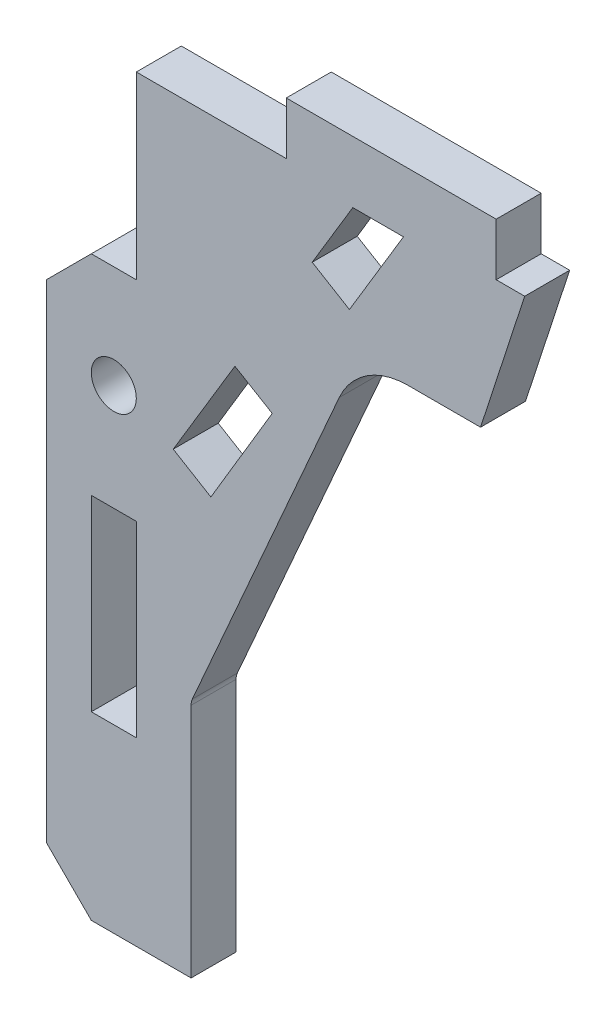
from build123d import *

# Parameters (mm, degrees)
SKETCH_1_R           = 1.5
SKETCH_1_W           = 3
SKETCH_1_H           = 12.5
EXTRUDE_1_DEPTH      = 3
SKETCH_2_W           = 3
SKETCH_2_H           = 15
SKETCH_2_H_2         = 10
CUT_EXTRUDE_1_DEPTH  = 5
CUT_EXTRUDE_2_DEPTH  = 45.402252195
CUT_EXTRUDE_3_DEPTH  = 10
CUT_EXTRUDE_4_DEPTH  = 10
EXTRUDE_2_DEPTH      = 3
EXTRUDE_3_DEPTH      = 3
CUT_EXTRUDE_5_DEPTH  = 8
FILLET_2_R           = 5
EXTRUDE_START        = -3
EXTRUDE_4_DEPTH      = 3
FILLET_3_R           = 2
EXTRUDE_5_DEPTH      = 3
FILLET_4_R           = 2
CUT_EXTRUDE_6_DEPTH  = 6
CUT_EXTRUDE_7_DEPTH  = 10
CUT_EXTRUDE_8_DEPTH  = 10
SKETCH_17_W          = 7
SKETCH_17_H          = 6.292526031
CUT_EXTRUDE_9_DEPTH  = 5
SKETCH_18_W          = 19.9
SKETCH_18_H          = 3.108254453
CUT_EXTRUDE_10_DEPTH = 45.402252195
EXTRUDE_6_DEPTH      = 3
SKETCH_20_W          = 3
SKETCH_20_H          = 12.985743467
EXTRUDE_7_DEPTH      = 7
EXTRUDE_9_DEPTH      = 3
EXTRUDE_10_DEPTH     = 5
EXTRUDE_11_DEPTH     = 3
FILLET_7_R           = 5
CUT_EXTRUDE_11_DEPTH = 10
FILLET_8_R           = 10
CUT_EXTRUDE_13_DEPTH = 10
SKETCH_32_W          = 3
SKETCH_32_H          = 8.565761419
EXTRUDE_12_DEPTH     = 0.5
FILLET_10_R          = 3
SKETCH_33_W          = 3
SKETCH_33_H          = 9.039454816
CUT_EXTRUDE_14_DEPTH = 5
CUT_EXTRUDE_15_DEPTH = 10
CUT_EXTRUDE_START    = -10
CUT_EXTRUDE_16_DEPTH = 10
CUT_EXTRUDE_18_DEPTH = 3
CUT_EXTRUDE_19_DEPTH = 10
CUT_EXTRUDE_20_DEPTH = 10
FILLET_11_R          = 1


with BuildPart() as part:
    # 草图1 → 凸台-拉伸1 (new body)
    with BuildSketch(Plane.XY):
        Polygon((-28.4, -17), (-25.4, -20), (-22.4, -20), (-22.4, -27.5), (17.4, -27.5), (17.4, -20), (22.4, -20), (22.4, -5), (17.4, -5), (17.4, 10), (22.4, 10), (22.4, 20), (17.4, 20), (17.4, 30.5), (1.6, 30.5), (1.6, 34), (-12.4, 34), (-12.4, 30.5), (-22.4, 30.5), (-22.4, 18.5), (-25.4, 18.5), (-28.4, 15.5), align=None)
        with Locations((-23.9, 11.645115951)):
            Circle(SKETCH_1_R, mode=Mode.SUBTRACT)
        with Locations((-23.9, -1.701184373)):
            Rectangle(SKETCH_1_W, SKETCH_1_H, mode=Mode.SUBTRACT)
        with BuildLine():
            Line((-0.943408492, 20.723063417), (-16.494006981, -16.074007029))
            ThreePointArc((-16.494006981, -16.074007029), (-16.597951499, -16.391745547), (-16.647518347, -16.722359153))
            Line((-16.647518347, -16.722359153), (-16.87747423, -20.247507648))
            ThreePointArc((-16.87747423, -20.247507648), (-16.341232813, -21.745107114), (-14.881716036, -22.377696869))
            Line((-14.881716036, -22.377696869), (7.4, -22.377696869))
            ThreePointArc((7.4, -22.377696869), (8.814213562, -21.791910432), (9.4, -20.377696869))
            Line((9.4, -20.377696869), (9.4, 19.944522071))
            ThreePointArc((9.4, 19.944522071), (8.814213562, 21.358735634), (7.4, 21.944522071))
            Line((7.4, 21.944522071), (0.898838335, 21.944522071))
            ThreePointArc((0.898838335, 21.944522071), (-0.206357871, 21.611417792), (-0.943408492, 20.723063417))
        make_face(mode=Mode.SUBTRACT)
    extrude(amount=EXTRUDE_1_DEPTH)

    # 草图2 → 切除-拉伸1 (cut)
    with BuildSketch(Plane(origin=(22.4, 0, 0), x_dir=(0, 0, -1), z_dir=(1, 0, 0))):
        with Locations((-1.5, -12.5)):
            Rectangle(SKETCH_2_W, SKETCH_2_H)
        with Locations((-1.5, 15)):
            Rectangle(SKETCH_2_W, SKETCH_2_H_2)
    extrude(amount=-CUT_EXTRUDE_1_DEPTH, mode=Mode.SUBTRACT)

    # 草图4 → 切除-拉伸2 (cut, through all)
    with BuildSketch(Plane(origin=(0, 0, 0), x_dir=(-1, 0, 0), z_dir=(0, 0, -1))):
        Polygon((-7.4, 21.944522071), (-17.4, 21.944522071), (-17.4, 1.5), (-9.4, 1.5), align=None)
    extrude(amount=-CUT_EXTRUDE_2_DEPTH, mode=Mode.SUBTRACT)

    # 草图5 → 切除-拉伸3 (cut)
    with BuildSketch(Plane(origin=(0, 0, 0), x_dir=(-1, 0, 0), z_dir=(0, 0, -1))):
        Polygon((-7.4, -22.377696869), (-17.4, -22.377696869), (-17.4, 1.5), (-9.4, 1.5), align=None)
    extrude(amount=-CUT_EXTRUDE_3_DEPTH, mode=Mode.SUBTRACT)

    # 草图6 → 切除-拉伸4 (cut)
    with BuildSketch(Plane(origin=(0, 0, 0), x_dir=(-1, 0, 0), z_dir=(0, 0, -1))):
        Polygon((-0.898838335, 21.944522071), (10.541314431, 21.944522071), (16.597951499, -16.391745547), align=None)
    extrude(amount=-CUT_EXTRUDE_4_DEPTH, mode=Mode.SUBTRACT)

    # 草图8 → 凸台-拉伸2 (add)
    with BuildSketch(Plane(origin=(0, 0, 0), x_dir=(-1, 0, 0), z_dir=(0, 0, -1))):
        with BuildLine():
            Line((14.881716036, -22.377696869), (-17.4, -22.377696869))
            Line((-17.4, -22.377696869), (-17.4, -16.722359153))
            Line((-17.4, -16.722359153), (16.647518347, -16.722359153))
            Line((16.647518347, -16.722359153), (16.87747423, -20.247507648))
            ThreePointArc((16.87747423, -20.247507648), (16.341232813, -21.745107114), (14.881716036, -22.377696869))
        make_face()
    extrude(amount=-EXTRUDE_2_DEPTH)

    # 草图9 → 凸台-拉伸3 (add)
    with BuildSketch(Plane(origin=(0, 0, 0), x_dir=(-1, 0, 0), z_dir=(0, 0, -1))):
        with BuildLine():
            Line((16.647518347, -16.722359153), (-17.4, -16.722359153))
            Line((-17.4, -16.722359153), (-17.4, -16.391745547))
            Line((-17.4, -16.391745547), (16.597951499, -16.391745547))
            ThreePointArc((16.597951499, -16.391745547), (16.629654964, -16.556014871), (16.647518347, -16.722359153))
        make_face()
    extrude(amount=-EXTRUDE_3_DEPTH)

    # 草图10 → 切除-拉伸5 (cut)
    with BuildSketch(Plane(origin=(0, 0, 0), x_dir=(-1, 0, 0), z_dir=(0, 0, -1))):
        Polygon((16.597951499, -16.391745547), (-17.4, -16.391745547), (-17.4, -18.391745547), (16.913925768, -18.391745547), align=None)
    extrude(amount=-CUT_EXTRUDE_5_DEPTH, mode=Mode.SUBTRACT)

    # 圆角2
    fillet_2_edges = [part.edges().sort_by_distance(p)[0] for p in [
        (-10.541314431, 21.944522071, 1.5),
    ]]
    fillet(fillet_2_edges, radius=FILLET_2_R)

    # 草图11 → 凸台-拉伸4 (add)
    with BuildSketch(Plane(origin=(0, 0, 0), x_dir=(-1, 0, 0), z_dir=(0, 0, -1)).offset(EXTRUDE_START)):
        with BuildLine():
            Line((6.269234856, 21.944522071), (11.207979364, 17.724780164))
            ThreePointArc((11.207979364, 17.724780164), (9.517211883, 20.745922501), (6.269234856, 21.944522071))
        make_face()
    extrude(amount=EXTRUDE_4_DEPTH)

    # 圆角3
    fillet_3_edges = [part.edges().sort_by_distance(p)[0] for p in [
        (-6.269234856, 21.944522071, 1.5),
        (-11.207979364, 17.724780164, 1.5),
    ]]
    fillet(fillet_3_edges, radius=FILLET_3_R)

    # 草图12 → 凸台-拉伸5 (add)
    with BuildSketch(Plane.XY.offset(3)):
        with BuildLine():
            Line((-7.981733094, 20.481336322), (-10.646847695, 18.204219992))
            ThreePointArc((-10.646847695, 18.204219992), (-11.092932914, 17.660394983), (-11.323154687, 16.995763057))
            Line((-11.323154687, 16.995763057), (-12.341298757, 10.55128849))
            Line((-12.341298757, 10.55128849), (-7.981733094, 20.481336322))
        make_face()
    extrude(amount=-EXTRUDE_5_DEPTH)

    # 圆角4
    fillet_4_edges = [part.edges().sort_by_distance(p)[0] for p in [
        (-7.981733094, 20.481336322, 1.5),
        (-12.341298757, 10.55128849, 1.5),
    ]]
    fillet(fillet_4_edges, radius=FILLET_4_R)

    # 草图14 → 切除-拉伸6 (cut)
    with BuildSketch(Plane.XY.offset(3)):
        with BuildLine():
            Line((-8.165767584, 20.062149772), (-6.345855602, 24.207473969))
            Line((-6.345855602, 24.207473969), (17.4, 24.207473969))
            Line((17.4, 24.207473969), (17.4, 21.944522071))
            Line((17.4, 21.944522071), (-5.531175714, 21.944522071))
            ThreePointArc((-5.531175714, 21.944522071), (-6.223591649, 21.820837655), (-6.830366525, 21.465082243))
            Line((-6.830366525, 21.465082243), (-7.633672538, 20.7787248))
            ThreePointArc((-7.633672538, 20.7787248), (-7.940203056, 20.450498062), (-8.165767584, 20.062149772))
        make_face()
    extrude(amount=-CUT_EXTRUDE_6_DEPTH, mode=Mode.SUBTRACT)

    # 草图15 → 切除-拉伸7 (cut)
    with BuildSketch(Plane.XY.offset(3)):
        Polygon((17.4, -18.391745547), (17.4, -22.391745547), (-17.545874306, -22.391745547), (-16.913925768, -18.391745547), align=None)
    extrude(amount=-CUT_EXTRUDE_7_DEPTH, mode=Mode.SUBTRACT)

    # 草图16 → 切除-拉伸8 (cut)
    with BuildSketch(Plane.XY.offset(3)):
        Polygon((17.4, -22.391745547), (17.4, -24.391745547), (-17.861848575, -24.391745547), (-17.545874306, -22.391745547), align=None)
    extrude(amount=-CUT_EXTRUDE_8_DEPTH, mode=Mode.SUBTRACT)

    # 草图17 → 切除-拉伸9 (cut)
    with BuildSketch(Plane.XY.offset(3)):
        with Locations((13.9, 27.353736985)):
            Rectangle(SKETCH_17_W, SKETCH_17_H)
    extrude(amount=-CUT_EXTRUDE_9_DEPTH, mode=Mode.SUBTRACT)

    # 草图18 → 切除-拉伸10 (cut, through all)
    with BuildSketch(Plane.XY.offset(3)):
        with Locations((7.45, -25.945872773)):
            Rectangle(SKETCH_18_W, SKETCH_18_H)
    extrude(amount=-CUT_EXTRUDE_10_DEPTH, mode=Mode.SUBTRACT)

    # 草图19 → 凸台-拉伸6 (add)
    with BuildSketch(Plane.XY.offset(3)):
        Polygon((10.4, -27.5), (10.4, -14.514256533), (-16.30133239, -14.514256533), (-17.861848575, -24.391745547), (-2.5, -24.391745547), (-2.5, -27.5), align=None)
    extrude(amount=-EXTRUDE_6_DEPTH)

    # 草图20 → 凸台-拉伸7 (add)
    with BuildSketch(Plane(origin=(10.4, 0, 0), x_dir=(0, 0, -1), z_dir=(1, 0, 0))):
        with Locations((-1.5, -21.007128267)):
            Rectangle(SKETCH_20_W, SKETCH_20_H)
    extrude(amount=EXTRUDE_7_DEPTH)

    # 草图22 → 凸台-拉伸9 (add)
    with BuildSketch(Plane.XY.offset(3)):
        Polygon((-16.220086474, -14), (-16.30133239, -14.514256533), (17.4, -14.514256533), (17.4, -14), align=None)
    extrude(amount=-EXTRUDE_9_DEPTH)

    # 草图23 → 凸台-拉伸10 (add)
    with BuildSketch(Plane(origin=(17.4, 0, 0), x_dir=(0, 0, -1), z_dir=(1, 0, 0))):
        Polygon((0, -16.75), (-3, -16.75), (-3, -20.75), (-3, -24.75), (0, -24.75), align=None)
    extrude(amount=EXTRUDE_10_DEPTH)

    # 草图25 → 凸台-拉伸11 (add)
    with BuildSketch(Plane.XY.offset(3)):
        Polygon((10.4, 21.460545184), (10.4, 24.207473969), (-6.345855602, 24.207473969), (-7.551833319, 21.460545184), align=None)
    extrude(amount=-EXTRUDE_11_DEPTH)

    # 圆角7
    fillet_7_edges = [part.edges().sort_by_distance(p)[0] for p in [
        (-7.551833319, 21.460545184, 1.5),
    ]]
    fillet(fillet_7_edges, radius=FILLET_7_R)

    # 草图26 → 切除-拉伸11 (cut)
    with BuildSketch(Plane.XY.offset(3)):
        Polygon((-16.220086474, -14), (-17.468499422, -21.901991212), (12.322607147, -22.558990573), (12.322607147, -14), align=None)
    extrude(amount=-CUT_EXTRUDE_11_DEPTH, mode=Mode.SUBTRACT)

    # 圆角8
    fillet_8_edges = [part.edges().sort_by_distance(p)[0] for p in [
        (-17.468499422, -21.901991212, 1.5),
    ]]
    fillet(fillet_8_edges, radius=FILLET_8_R)

    # 草图30 → 切除-拉伸13 (cut)
    with BuildSketch(Plane.XY.offset(3)):
        Polygon((13.4, -14), (12.322607147, -14), (12.322607147, -22.558990573), (13.4, -22.565761419), align=None)
    extrude(amount=-CUT_EXTRUDE_13_DEPTH, mode=Mode.SUBTRACT)

    # 草图32 → 凸台-拉伸12 (add)
    with BuildSketch(Plane.ZY.offset(-13.4)):
        with Locations((1.5, -18.282880709)):
            Rectangle(SKETCH_32_W, SKETCH_32_H)
    extrude(amount=EXTRUDE_12_DEPTH)

    # 圆角10
    fillet_10_edges = [part.edges().sort_by_distance(p)[0] for p in [
        (12.9, -22.562619183, 1.5),
    ]]
    fillet(fillet_10_edges, radius=FILLET_10_R)

    # 草图33 → 切除-拉伸14 (cut)
    with BuildSketch(Plane(origin=(10.4, 0, 0), x_dir=(0, 0, -1), z_dir=(1, 0, 0))):
        with Locations((-1.5, 25.980272592)):
            Rectangle(SKETCH_33_W, SKETCH_33_H)
    extrude(amount=-CUT_EXTRUDE_14_DEPTH, mode=Mode.SUBTRACT)

    # 草图34 → 切除-拉伸15 (cut)
    with BuildSketch(Plane.XY.offset(3)):
        Polygon((5.4, 30.5), (3.5, 30.5), (0.556836157, 21.460545184), (5.4, 21.460545184), align=None)
    extrude(amount=-CUT_EXTRUDE_15_DEPTH, mode=Mode.SUBTRACT)

    # 草图35 → 切除-拉伸16 (cut)
    with BuildSketch(Plane.XY.offset(3).offset(CUT_EXTRUDE_START)):
        with BuildLine():
            Line((-15.804851594, -12.15767545), (-15.803484574, -27.5))
            Line((-15.803484574, -27.5), (17.4, -27.5))
            Line((17.4, -27.5), (17.4, -24.75))
            Line((17.4, -24.75), (22.4, -24.75))
            Line((22.4, -24.75), (22.4, -16.75))
            Line((22.4, -16.75), (17.4, -16.75))
            Line((17.4, -16.75), (17.4, -14))
            Line((17.4, -14), (12.9, -14))
            Line((12.9, -14), (12.9, -19.50483406))
            ThreePointArc((12.9, -19.50483406), (11.997804375, -21.649412528), (9.833855463, -22.504104788))
            Line((9.833855463, -22.504104788), (-6.025333424, -22.154353531))
            ThreePointArc((-6.025333424, -22.154353531), (-12.953134992, -19.149784154), (-15.804851594, -12.15767545))
        make_face()
    extrude(amount=CUT_EXTRUDE_16_DEPTH, mode=Mode.SUBTRACT)

    # 草图37 → 切除-拉伸18 (cut)
    with BuildSketch(Plane(origin=(173.343153128, -117.958562534, 0), x_dir=(1, 0, 0), z_dir=(0, 0, -1))):
        Polygon((-181.304308857, -147.845632777), (-177.926170185, -147.845632777), (-181.530162889, -141.844696468), (-184.012835358, -143.335719369), align=None)
        Polygon((-189.167141698, -134.753386772), (-186.678220059, -133.271627751), (-190.77061716, -126.39759793), (-193.280214591, -127.904791202), align=None)
    extrude(amount=-CUT_EXTRUDE_18_DEPTH, mode=Mode.SUBTRACT)

    # 草图38 → 切除-拉伸19 (cut)
    with BuildSketch(Plane.XY.offset(3)):
        Polygon((-22.4, -20), (-22.4, -27.5), (-15.803484574, -27.5), (-15.804152833, -20), align=None)
    extrude(amount=-CUT_EXTRUDE_19_DEPTH, mode=Mode.SUBTRACT)

    # 草图39 → 切除-拉伸20 (cut)
    with BuildSketch(Plane.XY.offset(3).offset(CUT_EXTRUDE_START)):
        with BuildLine():
            Line((-12.381626222, 10.296030584), (-12.237414276, 10.787912491))
            Line((-12.237414276, 10.787912491), (-18.746477977, -4.038177739))
            Line((-18.746477977, -4.038177739), (-18.746477977, -20))
            Line((-18.746477977, -20), (-15.804152833, -20))
            Line((-15.804152833, -20), (-15.804851594, -12.15767545))
            ThreePointArc((-15.804851594, -12.15767545), (-15.774211698, -11.374569696), (-15.682340648, -10.596268253))
            Line((-15.682340648, -10.596268253), (-12.381626222, 10.296030584))
        make_face()
    extrude(amount=CUT_EXTRUDE_20_DEPTH, mode=Mode.SUBTRACT)

    # 圆角11
    fillet_11_edges = [part.edges().sort_by_distance(p)[0] for p in [
        (-18.746477977, -4.038177739, 1.5),
    ]]
    fillet(fillet_11_edges, radius=FILLET_11_R)


solid = part.part
